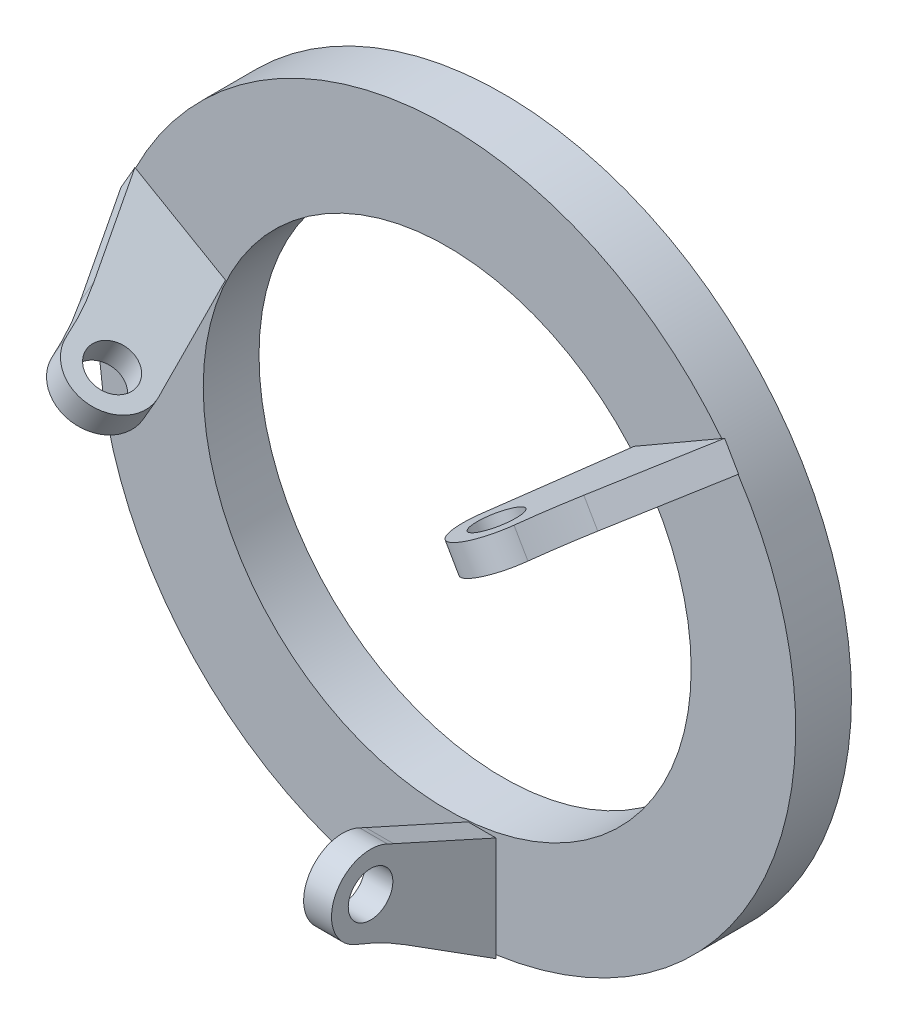
from build123d import *

# Parameters (mm, degrees)
SCHIZZO2_R                   = 25
SCHIZZO2_R_2                 = 17.5
ESTRUSIONE_ESTRUSIONE1_DEPTH = 4
SCHIZZO3_R                   = 1.6
ESTRUSIONE_ESTRUSIONE2_DEPTH = 2
RIPETIZIONECIRCOLARE1_COUNT  = 3


with BuildPart() as part:
    # Schizzo2 → Estrusione-Estrusione1 (new body)
    with BuildSketch(Plane.XY):
        Circle(SCHIZZO2_R)
        Circle(SCHIZZO2_R_2, mode=Mode.SUBTRACT)
    extrude(amount=ESTRUSIONE_ESTRUSIONE1_DEPTH)

    # Schizzo3 → Estrusione-Estrusione2 (add)
    with BuildSketch(Plane(origin=(-0.75, 1.299038106, 0), x_dir=(0, 0, -1), z_dir=(-0.5000000000000043, 0.866025403784436, 0))):
        with BuildLine():
            Line((-11.341531907, -14.184207936), (-4, -17.5))
            Line((-4, -17.5), (-4, -25))
            Line((-4, -25), (-10.523132314, -20.868682868))
            ThreePointArc((-10.523132314, -20.868682868), (-12.223574858, -19.90479517), (-14.009986273, -19.111499134))
            ThreePointArc((-14.009986273, -19.111499134), (-15.569198234, -15.386797217), (-11.785347493, -13.977180291))
            ThreePointArc((-11.785347493, -13.977180291), (-11.564073393, -14.082052593), (-11.341531907, -14.184207936))
        make_face()
        with Locations((-13, -16.5)):
            Circle(SCHIZZO3_R, mode=Mode.SUBTRACT)
    estrusione_estrusione2 = extrude(amount=ESTRUSIONE_ESTRUSIONE2_DEPTH)

    # RipetizioneCircolare1: Estrusione-Estrusione2 ×3 about axis
    ripetizionecircolare1_axis = Axis((0, 0, -0.2), (0, 0, 1))
    for i in range(1, RIPETIZIONECIRCOLARE1_COUNT):
        add(estrusione_estrusione2.rotate(ripetizionecircolare1_axis, i * 360 / RIPETIZIONECIRCOLARE1_COUNT))


solid = part.part
